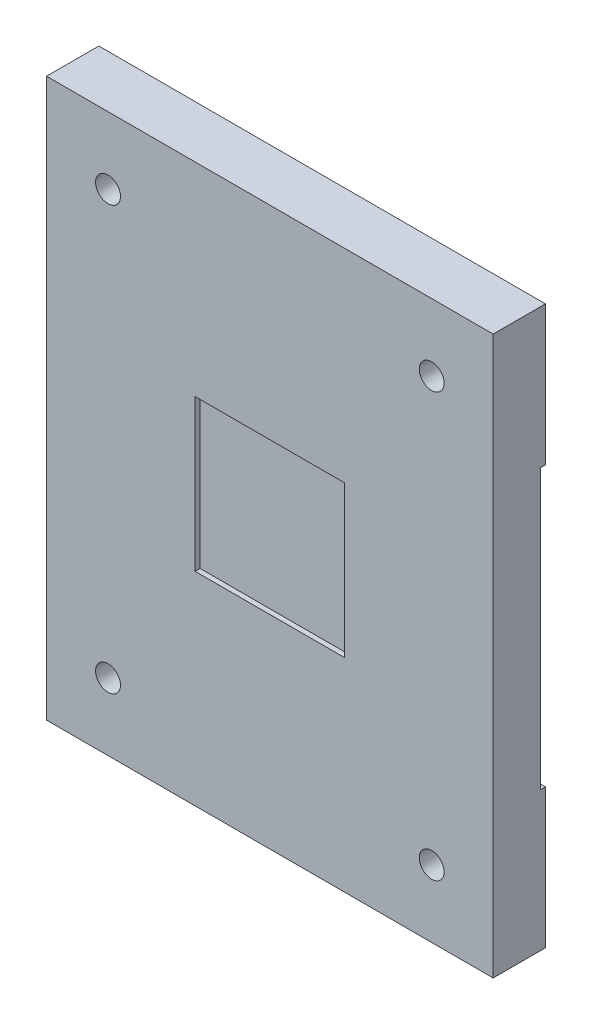
from build123d import *

# Parameters (mm, degrees)
SKETCH_1_W          = 89.7
SKETCH_1_H          = 112
EXTRUDE_1_DEPTH     = 10.5
CUT_EXTRUDE_1_DEPTH = 1
CUT_EXTRUDE_2_DEPTH = 1
SKETCH_4_R          = 5
CUT_EXTRUDE_3_DEPTH = 4
SKETCH_15_R         = 2.5
CUT_EXTRUDE_4_DEPTH = 10


with BuildPart() as part:
    # 草图1 → 凸台-拉伸1 (new body)
    with BuildSketch(Plane.XY):
        with Locations((17.35, -16.795754715)):
            Rectangle(SKETCH_1_W, SKETCH_1_H)
    extrude(amount=EXTRUDE_1_DEPTH)

    # 草图2 → 切除-拉伸1 (cut)
    with BuildSketch(Plane.XY.offset(10.5)):
        Polygon((17.35, -1.595754715), (32.35, -1.595754715), (32.35, -31.995754715), (2.35, -31.995754715), (2.35, -1.595754715), align=None)
    extrude(amount=-CUT_EXTRUDE_1_DEPTH, mode=Mode.SUBTRACT)

    # 草图3 → 切除-拉伸2 (cut)
    with BuildSketch(Plane(origin=(0, 0, 0), x_dir=(-1, 0, 0), z_dir=(0, 0, -1))):
        Polygon((-62.2, -16.795754715), (-62.2, -44.795754715), (27.5, -44.795754715), (27.5, 11.204245285), (-62.2, 11.204245285), align=None)
    extrude(amount=-CUT_EXTRUDE_2_DEPTH, mode=Mode.SUBTRACT)

    # 草图4 → 切除-拉伸3 (cut)
    with BuildSketch(Plane(origin=(0, 0, 0), x_dir=(-1, 0, 0), z_dir=(0, 0, -1))):
        with Locations((-49.85, 25.704245285)):
            Circle(SKETCH_4_R)
        with Locations(Location((15.15, 25.704245285, 0), (0, 0, 180))):
            Circle(SKETCH_4_R)
        with Locations((15.15, -59.295754715)):
            Circle(SKETCH_4_R)
        with Locations(Location((-49.85, -59.295754715, 0), (0, 0, 180))):
            Circle(SKETCH_4_R)
    extrude(amount=-CUT_EXTRUDE_3_DEPTH, mode=Mode.SUBTRACT)

    # 草图15 → 切除-拉伸4 (cut)
    with BuildSketch(Plane(origin=(0, 0, 4), x_dir=(-1, 0, 0), z_dir=(0, 0, -1))):
        with Locations((-49.85, 25.704245285)):
            Circle(SKETCH_15_R)
        with Locations((15.15, 25.704245285)):
            Circle(SKETCH_15_R)
        with Locations((-49.85, -59.295754715)):
            Circle(SKETCH_15_R)
        with Locations((15.15, -59.295754715)):
            Circle(SKETCH_15_R)
    extrude(amount=-CUT_EXTRUDE_4_DEPTH, mode=Mode.SUBTRACT)


solid = part.part
